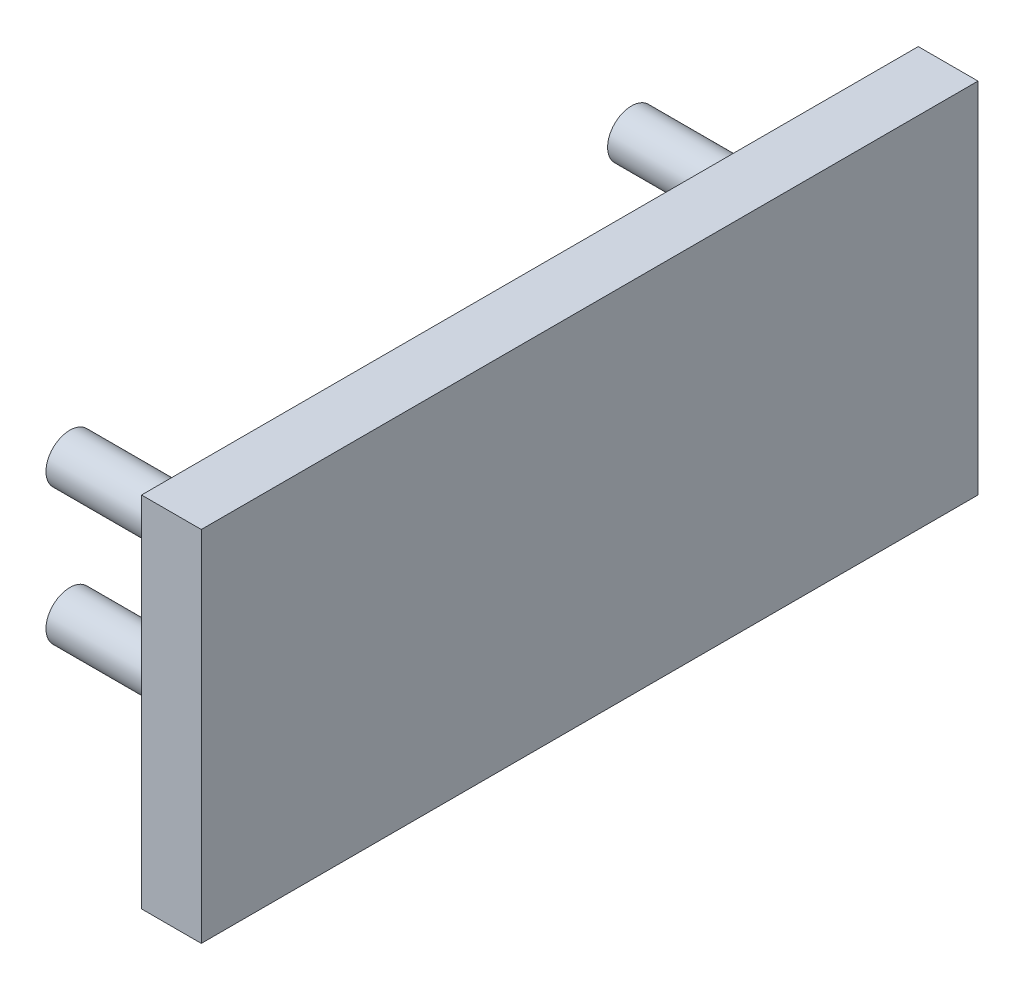
from build123d import *

# Parameters (mm, degrees)
SKETCH3_W           = 30
SKETCH3_H           = 65
BOSS_EXTRUDE1_DEPTH = 5
SKETCH4_R           = 2
BOSS_EXTRUDE2_DEPTH = 15


with BuildPart() as part:
    # Sketch3 → Boss-Extrude1 (new body)
    with BuildSketch(Plane.YZ):
        Rectangle(SKETCH3_W, SKETCH3_H)
    extrude(amount=BOSS_EXTRUDE1_DEPTH)

    # Sketch4 → Boss-Extrude2 (add)
    with BuildSketch(Plane(origin=(0, 0, 0), x_dir=(0, -1, 0), z_dir=(-1, 0, 0))):
        with Locations(Location((-5.7, -23.5, 0), (0, 0, 270))):
            Circle(SKETCH4_R)
        with Locations(Location((-5.7, 23.5, 0), (0, 0, 270))):
            Circle(SKETCH4_R)
        with Locations(Location((5.7, -23.5, 0), (0, 0, 270))):
            Circle(SKETCH4_R)
        with Locations(Location((5.7, 23.5, 0), (0, 0, 270))):
            Circle(SKETCH4_R)
    extrude(amount=BOSS_EXTRUDE2_DEPTH)


solid = part.part
